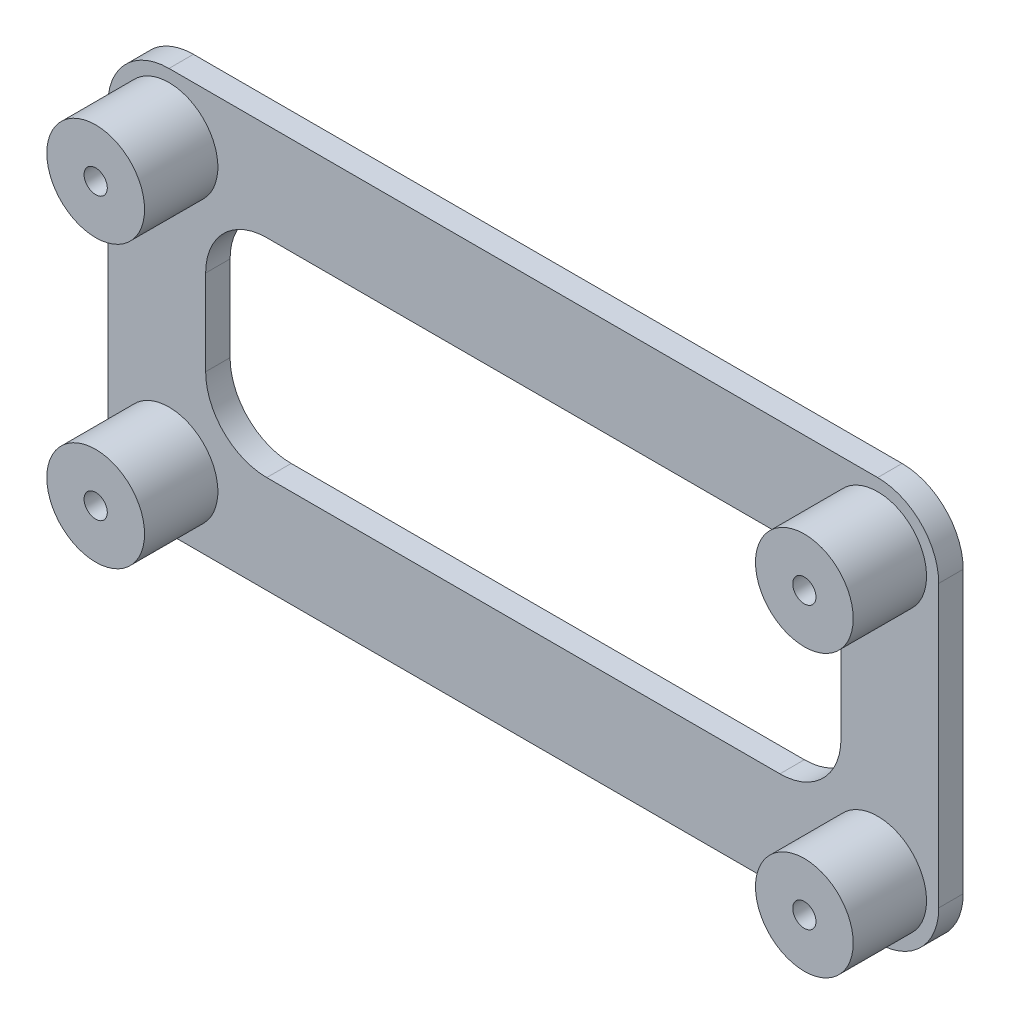
from build123d import *

# Parameters (mm, degrees)
SKETCH1_W           = 68
SKETCH1_H           = 33
SKETCH1_R           = 0.95
SKETCH1_W_2         = 52
SKETCH1_H_2         = 17
BOSS_EXTRUDE1_DEPTH = 2
SKETCH2_R           = 4
SKETCH2_R_2         = 0.95
BOSS_EXTRUDE2_DEPTH = 6
FILLET1_R           = 5


with BuildPart() as part:
    # Sketch1 → Boss-Extrude1 (new body)
    with BuildSketch(Plane.XY):
        Rectangle(SKETCH1_W, SKETCH1_H)
        with Locations((-29, 11.5)):
            Circle(SKETCH1_R, mode=Mode.SUBTRACT)
        with Locations((29, 11.5)):
            Circle(SKETCH1_R, mode=Mode.SUBTRACT)
        with Locations((29, -11.5)):
            Circle(SKETCH1_R, mode=Mode.SUBTRACT)
        with Locations((-29, -11.5)):
            Circle(SKETCH1_R, mode=Mode.SUBTRACT)
        Rectangle(SKETCH1_W_2, SKETCH1_H_2, mode=Mode.SUBTRACT)
    extrude(amount=BOSS_EXTRUDE1_DEPTH)

    # Sketch2 → Boss-Extrude2 (add)
    # profile 1 of 4: a face of its own
    with BuildSketch(Plane.XY.offset(2)):
        with Locations(Location((-29, 11.5, 0), (0, 0, 180))):
            Circle(SKETCH2_R)
        with Locations((-29, 11.5)):
            Circle(SKETCH2_R_2, mode=Mode.SUBTRACT)
    # profile 2 of 4: a face of its own
    with BuildSketch(Plane.XY.offset(2)):
        with Locations(Location((29, 11.5, 0), (0, 0, 180))):
            Circle(SKETCH2_R)
        with Locations((29, 11.5)):
            Circle(SKETCH2_R_2, mode=Mode.SUBTRACT)
    # profile 3 of 4: a face of its own
    with BuildSketch(Plane.XY.offset(2)):
        with Locations(Location((29, -11.5, 0), (0, 0, 180))):
            Circle(SKETCH2_R)
        with Locations((29, -11.5)):
            Circle(SKETCH2_R_2, mode=Mode.SUBTRACT)
    # profile 4 of 4: a face of its own
    with BuildSketch(Plane.XY.offset(2)):
        with Locations(Location((-29, -11.5, 0), (0, 0, 180))):
            Circle(SKETCH2_R)
        with Locations((-29, -11.5)):
            Circle(SKETCH2_R_2, mode=Mode.SUBTRACT)
    extrude(amount=BOSS_EXTRUDE2_DEPTH)

    # Fillet1
    fillet1_edges = [part.edges().sort_by_distance(p)[0] for p in [
        (26, -8.5, 1),
        (26, 8.5, 1),
        (-26, 8.5, 1),
        (-26, -8.5, 1),
        (34, -16.5, 1),
        (-34, -16.5, 1),
        (-34, 16.5, 1),
        (34, 16.5, 1),
    ]]
    fillet(fillet1_edges, radius=FILLET1_R)


solid = part.part
